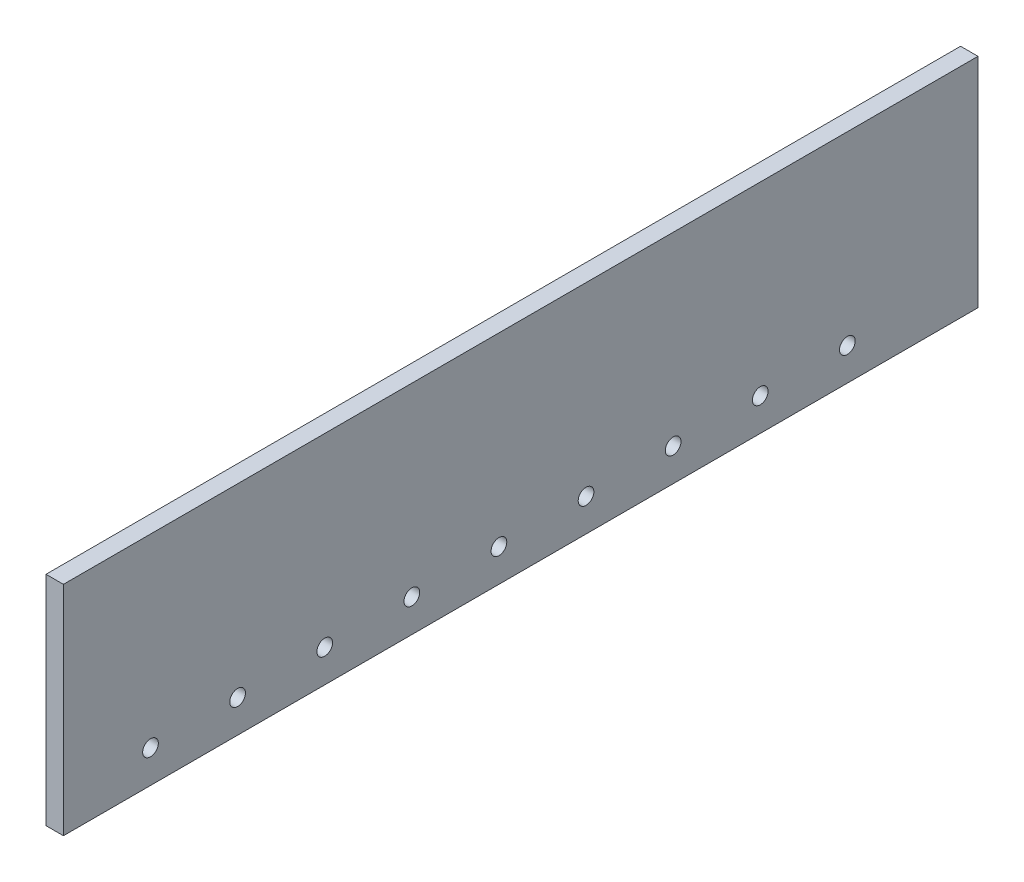
from build123d import *

# Parameters (mm, degrees)
SKETCH2_W           = 210
SKETCH2_H           = 50
SKETCH2_R           = 1.8
BOSS_EXTRUDE1_DEPTH = 4


with BuildPart() as part:
    # Sketch2 → Boss-Extrude1 (new body)
    with BuildSketch(Plane(origin=(0, 0, 0), x_dir=(0, 0, -1), z_dir=(1, 0, 0))):
        with Locations((20.740740741, 25.216049383)):
            Rectangle(SKETCH2_W, SKETCH2_H)
        with Locations((-64.259259259, 7.716049383)):
            Circle(SKETCH2_R, mode=Mode.SUBTRACT)
        with Locations((-44.259259259, 7.716049383)):
            Circle(SKETCH2_R, mode=Mode.SUBTRACT)
        with Locations((-24.259259259, 7.716049383)):
            Circle(SKETCH2_R, mode=Mode.SUBTRACT)
        with Locations((-4.259259259, 7.716049383)):
            Circle(SKETCH2_R, mode=Mode.SUBTRACT)
        with Locations((15.740740741, 7.716049383)):
            Circle(SKETCH2_R, mode=Mode.SUBTRACT)
        with Locations((35.740740741, 7.716049383)):
            Circle(SKETCH2_R, mode=Mode.SUBTRACT)
        with Locations((55.740740741, 7.716049383)):
            Circle(SKETCH2_R, mode=Mode.SUBTRACT)
        with Locations((75.740740741, 7.716049383)):
            Circle(SKETCH2_R, mode=Mode.SUBTRACT)
        with Locations((95.740740741, 7.716049383)):
            Circle(SKETCH2_R, mode=Mode.SUBTRACT)
    extrude(amount=BOSS_EXTRUDE1_DEPTH)


solid = part.part
